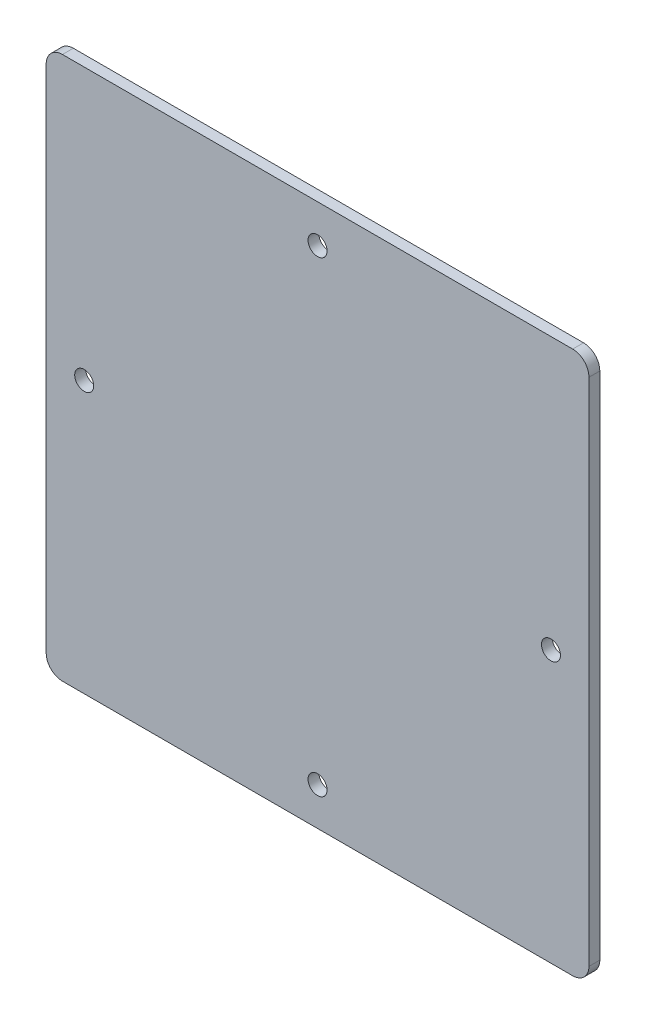
from build123d import *

# Parameters (mm, degrees)
ESBO_O1_R                = 1.75
RESSALTO_EXTRUS_O1_DEPTH = 2


with BuildPart() as part:
    # Esboço1 → Ressalto-extrusão1 (new body)
    with BuildSketch(Plane.XY):
        with BuildLine():
            Line((-47, 50), (47, 50))
            ThreePointArc((47, 50), (49.121320344, 49.121320344), (50, 47))
            Line((50, 47), (50, -47))
            ThreePointArc((50, -47), (49.121320344, -49.121320344), (47, -50))
            Line((47, -50), (-47, -50))
            ThreePointArc((-47, -50), (-49.121320344, -49.121320344), (-50, -47))
            Line((-50, -47), (-50, 47))
            ThreePointArc((-50, 47), (-49.121320344, 49.121320344), (-47, 50))
        make_face()
        with Locations((-43, 0)):
            Circle(ESBO_O1_R, mode=Mode.SUBTRACT)
        with Locations((0, 43)):
            Circle(ESBO_O1_R, mode=Mode.SUBTRACT)
        with Locations((43, 0)):
            Circle(ESBO_O1_R, mode=Mode.SUBTRACT)
        with Locations((0, -43)):
            Circle(ESBO_O1_R, mode=Mode.SUBTRACT)
    extrude(amount=RESSALTO_EXTRUS_O1_DEPTH)


solid = part.part
